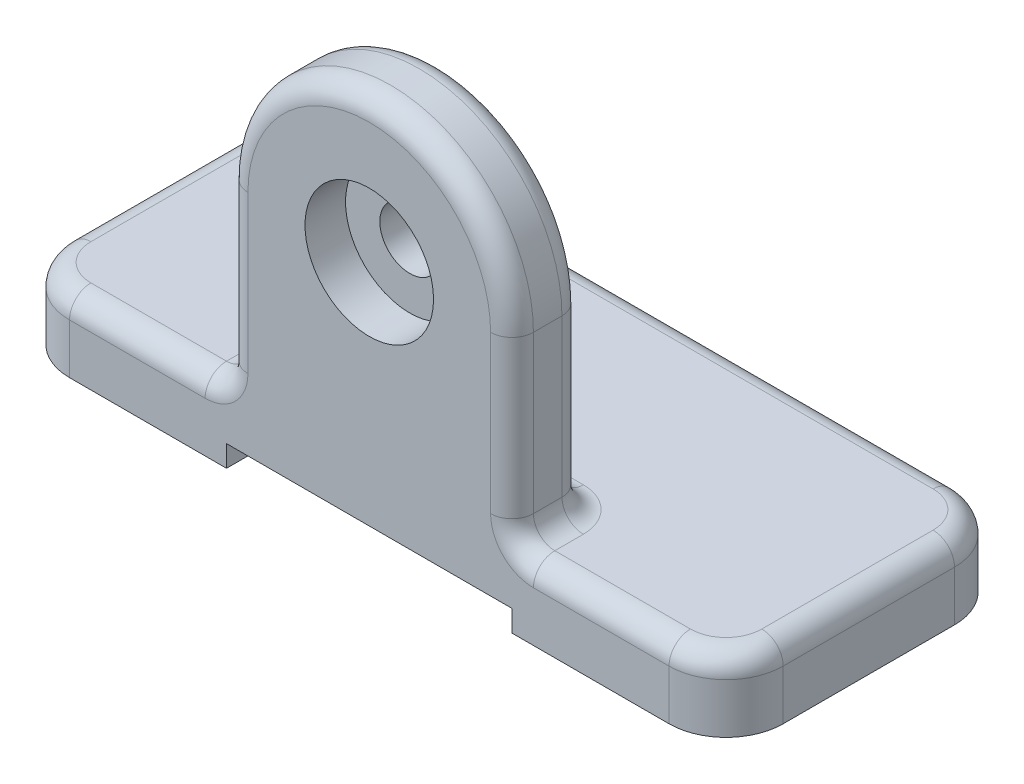
from build123d import *

# Parameters (mm, degrees)
SKETCH_1_W                   = 100
SKETCH_1_H                   = 40
EXTRUDE_1_DEPTH              = 10
EXTRUDE_2_DEPTH              = 10
SKETCH_3_W                   = 40
SKETCH_3_H                   = 3
CUT_EXTRUDE_1_DEPTH          = 85.409715081
HOLE_WIZARD_M8_1_D           = 8.4
HOLE_WIZARD_M8_1_CBORE_D     = 18.01
HOLE_WIZARD_M8_1_CBORE_DEPTH = 5.68
FILLET_1_R                   = 8
FILLET_2_R                   = 3


with BuildPart() as part:
    # 스케치1 → 보스-돌출1 (new body)
    with BuildSketch(Plane(origin=(0, 0, 0), x_dir=(1, 0, 0), z_dir=(0, 1, 0))):
        with Locations((0, 20)):
            Rectangle(SKETCH_1_W, SKETCH_1_H)
    extrude(amount=EXTRUDE_1_DEPTH)

    # 스케치2 → 보스-돌출2 (add)
    with BuildSketch(Plane.XY):
        with BuildLine():
            Line((-20, 0), (-20, 35))
            ThreePointArc((-20, 35), (0, 55), (20, 35))
            Line((20, 35), (20, 0))
            Line((20, 0), (-20, 0))
        make_face()
    extrude(amount=-EXTRUDE_2_DEPTH)

    # 스케치3 → 컷-돌출1 (cut, through all)
    with BuildSketch(Plane.XY):
        with Locations((0, 1.5)):
            Rectangle(SKETCH_3_W, SKETCH_3_H)
    extrude(amount=-CUT_EXTRUDE_1_DEPTH, mode=Mode.SUBTRACT)

    # M8 육각 머리 볼트용 카운터보어1 (through all)
    with Locations(Plane(origin=(0, 35, 0), x_dir=(1, 0, 0), z_dir=(0, 0, 1))):
        with Locations((0, 0)):
            CounterBoreHole(HOLE_WIZARD_M8_1_D / 2, HOLE_WIZARD_M8_1_CBORE_D / 2, HOLE_WIZARD_M8_1_CBORE_DEPTH)

    # 필렛1
    fillet_1_edges = [part.edges().sort_by_distance(p)[0] for p in [
        (-50, 5, -40),
        (50, 5, -40),
        (50, 5, 0),
        (-50, 5, 0),
    ]]
    fillet(fillet_1_edges, radius=FILLET_1_R)

    # 필렛2
    fillet_2_edges = [part.edges().sort_by_distance(p)[0] for p in [
        (31, 10, 0),
        (-20, 22.5, -10),
        (20, 22.5, -10),
        (-20, 22.5, 0),
        (20, 22.5, 0),
        (0, 55, 0),
        (-20, 10, -5),
        (0, 55, -10),
        (20, 10, -5),
        (0, 10, -10),
        (-31, 10, 0),
        (-50, 10, -20),
        (50, 10, -20),
        (0, 10, -40),
        (47.656854249, 10, -37.656854249),
        (47.656854249, 10, -2.343145751),
        (-47.656854249, 10, -37.656854249),
        (-47.656854249, 10, -2.343145751),
    ]]
    fillet(fillet_2_edges, radius=FILLET_2_R)


solid = part.part
